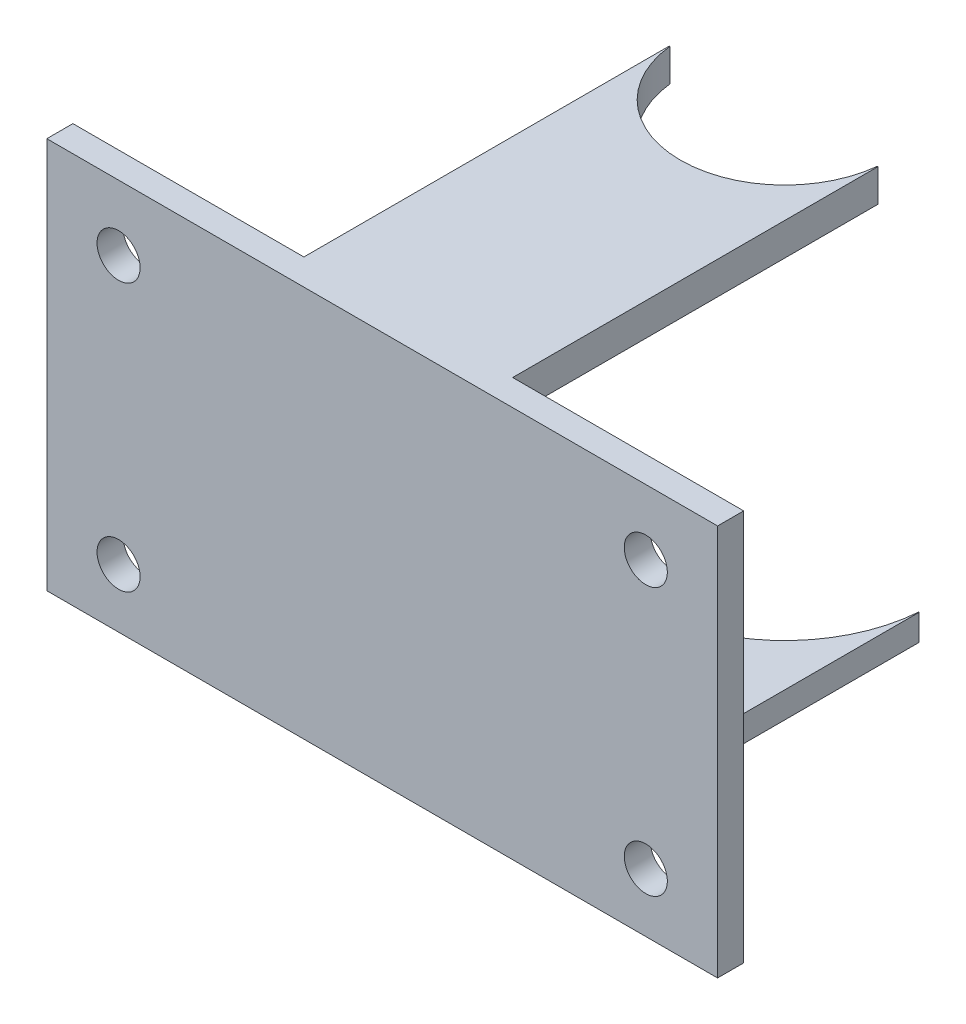
from build123d import *

# Parameters (mm, degrees)
SKETCH1_W           = 51.4
SKETCH1_H           = 30
BOSS_EXTRUDE1_DEPTH = 2
SKETCH2_R           = 1.65
CUT_EXTRUDE1_DEPTH  = 15
SKETCH3_W           = 16
SKETCH3_H           = 2.5
SKETCH3_W_2         = 22.3
SKETCH3_H_2         = 2
BOSS_EXTRUDE2_DEPTH = 28
SKETCH4_R           = 8
CUT_EXTRUDE3_DEPTH  = 10
SKETCH6_R           = 11.15
CUT_EXTRUDE4_DEPTH  = 10


with BuildPart() as part:
    # Sketch1 → Boss-Extrude1 (new body)
    with BuildSketch(Plane.XY):
        with Locations((25.7, 15)):
            Rectangle(SKETCH1_W, SKETCH1_H)
    extrude(amount=BOSS_EXTRUDE1_DEPTH)

    # Sketch2 → Cut-Extrude1 (cut)
    with BuildSketch(Plane(origin=(0, 0, 0), x_dir=(-1, 0, 0), z_dir=(0, 0, -1))):
        with Locations((-45.9, 25)):
            Circle(SKETCH2_R)
        with Locations((-5.5, 25)):
            Circle(SKETCH2_R)
        with Locations((-5.5, 4.5)):
            Circle(SKETCH2_R)
        with Locations((-45.9, 4.5)):
            Circle(SKETCH2_R)
    extrude(amount=-CUT_EXTRUDE1_DEPTH, mode=Mode.SUBTRACT)

    # Sketch3 → Boss-Extrude2 (add)
    with BuildSketch(Plane(origin=(0, 0, 0), x_dir=(-1, 0, 0), z_dir=(0, 0, -1))):
        with Locations((-25.7, 28.75)):
            Rectangle(SKETCH3_W, SKETCH3_H)
        with Locations((-25.7, 1)):
            Rectangle(SKETCH3_W_2, SKETCH3_H_2)
    extrude(amount=BOSS_EXTRUDE2_DEPTH)

    # Sketch4 → Cut-Extrude3 (cut)
    with BuildSketch(Plane(origin=(0, 30, 0), x_dir=(1, 0, 0), z_dir=(0, 1, 0))):
        with Locations((25.7, 28.85)):
            Circle(SKETCH4_R)
    extrude(amount=-CUT_EXTRUDE3_DEPTH, mode=Mode.SUBTRACT)

    # Sketch6 → Cut-Extrude4 (cut)
    with BuildSketch(Plane(origin=(0, 2, 0), x_dir=(1, 0, 0), z_dir=(0, 1, 0))):
        with Locations((25.7, 28.85)):
            Circle(SKETCH6_R)
    extrude(amount=-CUT_EXTRUDE4_DEPTH, mode=Mode.SUBTRACT)


solid = part.part
